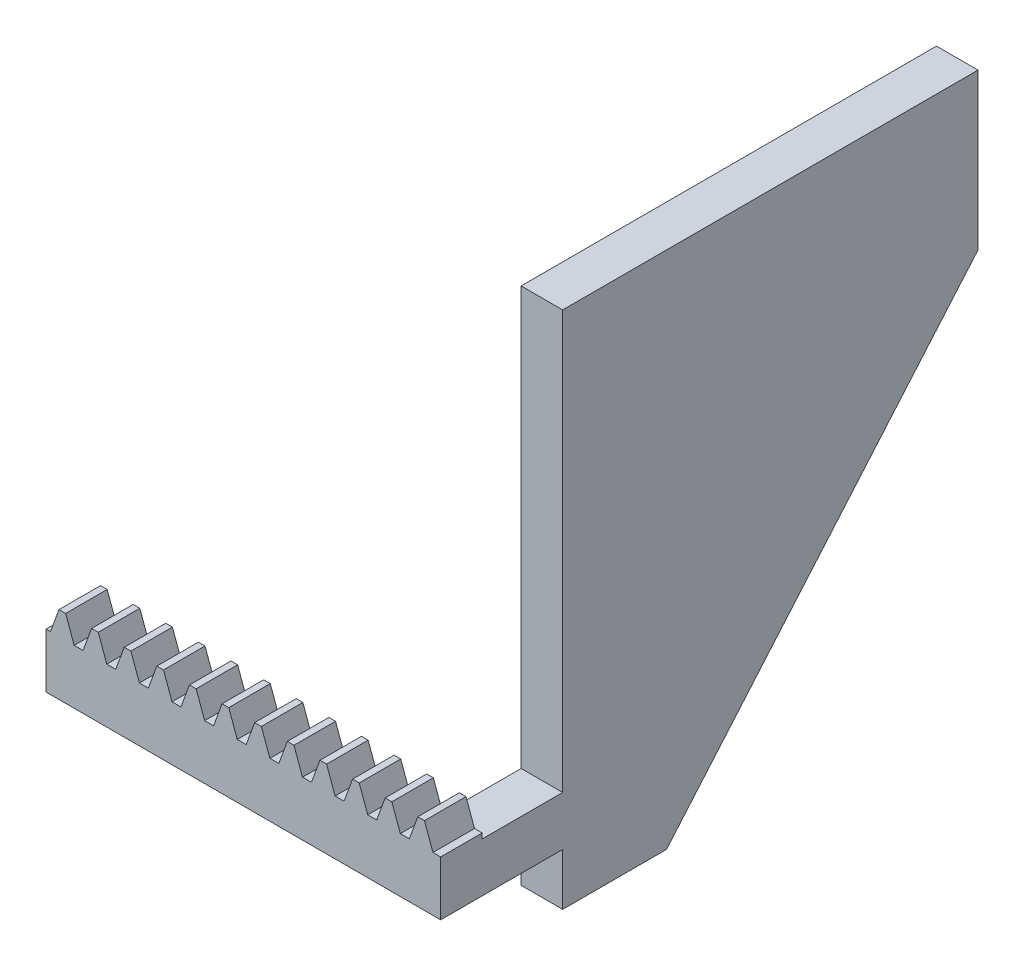
from build123d import *

# Parameters (mm, degrees)
BLANKSKE_W          = 120
BLANKSKE_H          = 16
BLANK_DEPTH         = 8
TOOTHCUTSIM_DEPTH   = 122.326007105
TEETHCUTS_COUNT     = 20
TEETHCUTS_PITCH     = 6.2831853
SKETCH1_W           = 8
SKETCH1_H           = 1
CUT_EXTRUDE1_DEPTH  = 122.326007105
BOSS_EXTRUDE2_DEPTH = 8
CUT_EXTRUDE2_DEPTH  = 183.738200713


with BuildPart() as part:
    # BlankSke → Blank (new body)
    with BuildSketch(Plane.XY):
        with Locations((60, 8)):
            Rectangle(BLANKSKE_W, BLANKSKE_H)
    extrude(amount=-BLANK_DEPTH)

    # TooCutSkeSim → ToothCutSim (cut, through all)
    with BuildSketch(Plane.XY):
        Polygon((0.861870739, 11.5), (-0.861870739, 11.5), (-2.508981637, 16.0254), (2.508981637, 16.0254), align=None)
    toothcutsim = extrude(amount=-TOOTHCUTSIM_DEPTH, mode=Mode.SUBTRACT)

    # TeethCuts: ToothCutSim ×20
    with Locations(*[(i * TEETHCUTS_PITCH, 0, 0) for i in range(1, TEETHCUTS_COUNT)]):
        add(toothcutsim, mode=Mode.SUBTRACT)

    # Sketch1 → Cut-Extrude1 (cut, through all)
    with BuildSketch(Plane(origin=(120, 0, 0), x_dir=(0, 0, -1), z_dir=(1, 0, 0))):
        with Locations((4, 0.5)):
            Rectangle(SKETCH1_W, SKETCH1_H)
    extrude(amount=-CUT_EXTRUDE1_DEPTH, mode=Mode.SUBTRACT)

    # Sketch2 → Boss-Extrude2 (add)
    with BuildSketch(Plane(origin=(120, 0, 0), x_dir=(0, 0, -1), z_dir=(1, 0, 0))):
        Polygon((8, 1), (23.5, 1), (23.5, -9), (43.5, -9), (103.5, 61), (103.5, 91), (23.5, 91), (23.5, 10.5), (8, 10.5), align=None)
    extrude(amount=-BOSS_EXTRUDE2_DEPTH)

    # Sketch3 → Cut-Extrude2 (cut, through all)
    with BuildSketch(Plane.XY):
        with BuildLine():
            Line((0, 1), (0, 11.5))
            ThreePointArc((0, 11.5), (0.43093537, 11.93093537), (0.861870739, 11.5))
            Line((0.861870739, 11.5), (2.499736794, 16))
            Line((2.499736794, 16), (3.783448506, 16))
            Line((3.783448506, 16), (5.421314561, 11.5))
            Line((5.421314561, 11.5), (7.145056039, 11.5))
            Line((7.145056039, 11.5), (8.782922094, 16))
            Line((8.782922094, 16), (10.066633806, 16))
            Line((10.066633806, 16), (11.704499861, 11.5))
            Line((11.704499861, 11.5), (13.428241339, 11.5))
            Line((13.428241339, 11.5), (15.066107394, 16))
            Line((15.066107394, 16), (15.70796325, 16))
            Line((15.70796325, 16), (16.349819106, 16))
            Line((16.349819106, 16), (17.987685161, 11.5))
            Line((17.987685161, 11.5), (19.711426639, 11.5))
            Line((19.711426639, 11.5), (21.349292694, 16))
            Line((21.349292694, 16), (22.633004406, 16))
            Line((22.633004406, 16), (24.270870461, 11.5))
            Line((24.270870461, 11.5), (25.994611939, 11.5))
            Line((25.994611939, 11.5), (27.632477994, 16))
            Line((27.632477994, 16), (28.916189706, 16))
            Line((28.916189706, 16), (30.554055761, 11.5))
            Line((30.554055761, 11.5), (32.277797239, 11.5))
            Line((32.277797239, 11.5), (33.915663294, 16))
            Line((33.915663294, 16), (35.199375006, 16))
            Line((35.199375006, 16), (36.837241061, 11.5))
            Line((36.837241061, 11.5), (37.6991118, 11.5))
            Line((37.6991118, 11.5), (38.560982539, 11.5))
            Line((38.560982539, 11.5), (40.198848594, 16))
            Line((40.198848594, 16), (41.482560306, 16))
            Line((41.482560306, 16), (43.120426361, 11.5))
            Line((43.120426361, 11.5), (43.9822971, 11.5))
            Line((43.9822971, 11.5), (43.9822971, 1))
            Line((43.9822971, 1), (37.6991118, 1))
            Line((37.6991118, 1), (17.987685161, 1))
            Line((17.987685161, 1), (15.70796325, 1))
            Line((15.70796325, 1), (6.161314561, 1))
            Line((6.161314561, 1), (0, 1))
        make_face()
    extrude(amount=-CUT_EXTRUDE2_DEPTH, mode=Mode.SUBTRACT)


solid = part.part
